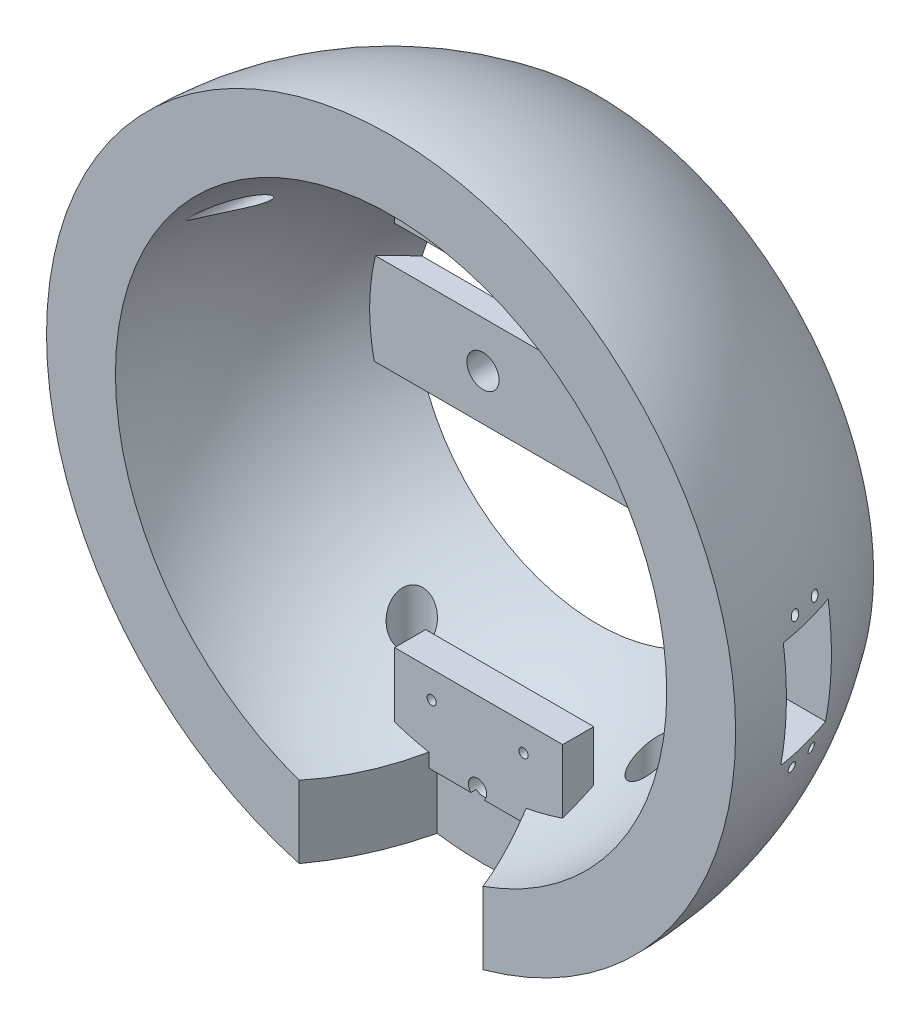
from build123d import *

# Parameters (mm, degrees)
REVOLU_O1_ANGLE               = 180
ESBO_O5_R                     = 3.95
CORTE_EXTRUS_O2_DEPTH         = 130.903810568
ESBO_O6_R                     = 3.95
CORTE_EXTRUS_O4_DEPTH         = 130.903810568
ESBO_O7_W                     = 13.2
ESBO_O7_H                     = 23.4
CORTE_EXTRUS_O5_DEPTH         = 130.903810568
CORTE_EXTRUS_O6_DEPTH         = 130.903810568
ESBO_O9_R                     = 1
CORTE_EXTRUS_O7_DEPTH         = 99
RESSALTO_EXTRUS_O2_DEPTH      = 60
RESSALTO_EXTRUS_O2_DEPTH_BACK = 59
ESBO_O10_W                    = 36.584636638
ESBO_O10_H                    = 6.768963607
ESBO_O11_W                    = 40
ESBO_O11_H                    = 80
CORTE_EXTRUS_O8_DEPTH         = 28
SKETCH5_W                     = 151.892727848
SKETCH5_H                     = 155.817604536
CUT_EXTRUDE2_DEPTH            = 45
SKETCH8_R                     = 2
CUT_EXTRUDE3_DEPTH            = 45
SKETCH10_W                    = 99.69186789
SKETCH10_H                    = 20.016871112
BOSS_EXTRUDE2_DEPTH           = 5
SKETCH11_R                    = 3.5
CUT_EXTRUDE5_DEPTH            = 44
ESBO_O12_R                    = 1
CUT_EXTRUDE6_DEPTH            = 32


with BuildPart() as part:
    # Esboço1 → Revolução1 (revolve)
    with BuildSketch(Plane.XY):
        with BuildLine():
            Line((-60, 0), (-75, 0))
            ThreePointArc((-75, 0), (0, 75), (75, 0))
            Line((75, 0), (60, 0))
            ThreePointArc((60, 0), (0, 60), (-60, 0))
        make_face()
    revolve(axis=Axis((-60, 0, 0), (-1, 0, 0)), revolution_arc=REVOLU_O1_ANGLE)

    # Esboço5 → Corte-extrusão2 (cut, through all)
    with BuildSketch(Plane(origin=(0, 0, 0), x_dir=(1, 0, 0), z_dir=(0, 1, 0))):
        with Locations((26, 30.5)):
            Circle(ESBO_O5_R)
        with Locations((-26, 30.5)):
            Circle(ESBO_O5_R)
    extrude(amount=-CORTE_EXTRUS_O2_DEPTH, mode=Mode.SUBTRACT)

    # Esboço6 → Corte-extrusão4 (cut, through all)
    with BuildSketch(Plane.XY):
        with Locations((-7.5, 0)):
            Circle(ESBO_O6_R)
        with Locations((7.5, 0)):
            Circle(ESBO_O6_R)
    extrude(amount=-CORTE_EXTRUS_O4_DEPTH, mode=Mode.SUBTRACT)

    # Esboço7 → Corte-extrusão5 (cut, through all)
    with BuildSketch(Plane(origin=(0, 0, 0), x_dir=(0, 0, -1), z_dir=(1, 0, 0))):
        with Locations((18.6, -1.7)):
            Rectangle(ESBO_O7_W, ESBO_O7_H)
    extrude(amount=CORTE_EXTRUS_O5_DEPTH, mode=Mode.SUBTRACT)

    # Esboço8 → Corte-extrusão6 (cut, through all)
    with BuildSketch(Plane(origin=(0, 0, 0), x_dir=(1, 0, 0), z_dir=(0, 1, 0))):
        Polygon((0, 20), (10, 20), (20, 0), (0, 0), (-20, 0), (-10, 20), align=None)
    extrude(amount=-CORTE_EXTRUS_O6_DEPTH, mode=Mode.SUBTRACT)

    # Esboço9 → Corte-extrusão7 (cut)
    with BuildSketch(Plane(origin=(0, 0, 0), x_dir=(0, 0, -1), z_dir=(1, 0, 0))):
        with Locations((15.7, 12.8)):
            Circle(ESBO_O9_R)
        with Locations((21.5, 12.8)):
            Circle(ESBO_O9_R)
        with Locations((15.7, -16.2)):
            Circle(ESBO_O9_R)
        with Locations((21.5, -16.2)):
            Circle(ESBO_O9_R)
    extrude(amount=CORTE_EXTRUS_O7_DEPTH, mode=Mode.SUBTRACT)

    # Esboço10 → Ressalto-extrusão2 (add, two sides: drawn at the far end of the back side and taken through both)
    with BuildSketch(Plane(origin=(0, 0, 0), x_dir=(1, 0, 0), z_dir=(0, 1, 0)).offset(-RESSALTO_EXTRUS_O2_DEPTH_BACK)):
        with Locations((0.224643111, 22.20508955)):
            Rectangle(ESBO_O10_W, ESBO_O10_H)
    extrude(amount=RESSALTO_EXTRUS_O2_DEPTH + RESSALTO_EXTRUS_O2_DEPTH_BACK)

    # Esboço11 → Corte-extrusão8 (cut)
    with BuildSketch(Plane.XY):
        Rectangle(ESBO_O11_W, ESBO_O11_H)
    extrude(amount=-CORTE_EXTRUS_O8_DEPTH, mode=Mode.SUBTRACT)

    # Sketch5 → Cut-Extrude2 (cut)
    with BuildSketch(Plane.XY.offset(-45)):
        with Locations((0.981219172, -1.373706841)):
            Rectangle(SKETCH5_W, SKETCH5_H)
    extrude(amount=-CUT_EXTRUDE2_DEPTH, mode=Mode.SUBTRACT)

    # Sketch8 → Cut-Extrude3 (cut)
    with BuildSketch(Plane(origin=(0, 0, -45), x_dir=(-1, 0, 0), z_dir=(0, 0, -1))):
        with Locations((0, -57.602)):
            Circle(SKETCH8_R)
        with Locations((-49.884795309, 28.801)):
            Circle(SKETCH8_R)
        with Locations((49.884795309, 28.801)):
            Circle(SKETCH8_R)
    extrude(amount=-CUT_EXTRUDE3_DEPTH, mode=Mode.SUBTRACT)

    # Esboço12 → Cut-Extrude6 (cut)
    with BuildSketch(Plane.XY):
        with Locations((-10, -45.857367591)):
            Circle(ESBO_O12_R)
        with Locations((10, -45.857367591)):
            Circle(ESBO_O12_R)
        with Locations((10, 45.857367591)):
            Circle(ESBO_O12_R)
        with Locations((-10, 45.857367591)):
            Circle(ESBO_O12_R)
    extrude(amount=-CUT_EXTRUDE6_DEPTH, mode=Mode.SUBTRACT)


with BuildPart() as body_2:
    # Sketch10 → Boss-Extrude2 (new body)
    with BuildSketch(Plane(origin=(0, 0, -45), x_dir=(-1, 0, 0), z_dir=(0, 0, -1))):
        with Locations((1.962438344, 0.588731503)):
            Rectangle(SKETCH10_W, SKETCH10_H)
    extrude(amount=-BOSS_EXTRUDE2_DEPTH)

    # Sketch11 → Cut-Extrude5 (cut)
    with BuildSketch(Plane.XY.offset(-45)):
        with Locations((20, 0.588731503)):
            Circle(SKETCH11_R)
        with Locations((-20, 0.588731503)):
            Circle(SKETCH11_R)
    extrude(amount=CUT_EXTRUDE5_DEPTH, mode=Mode.SUBTRACT)


solid = Compound([part.part, body_2.part])
